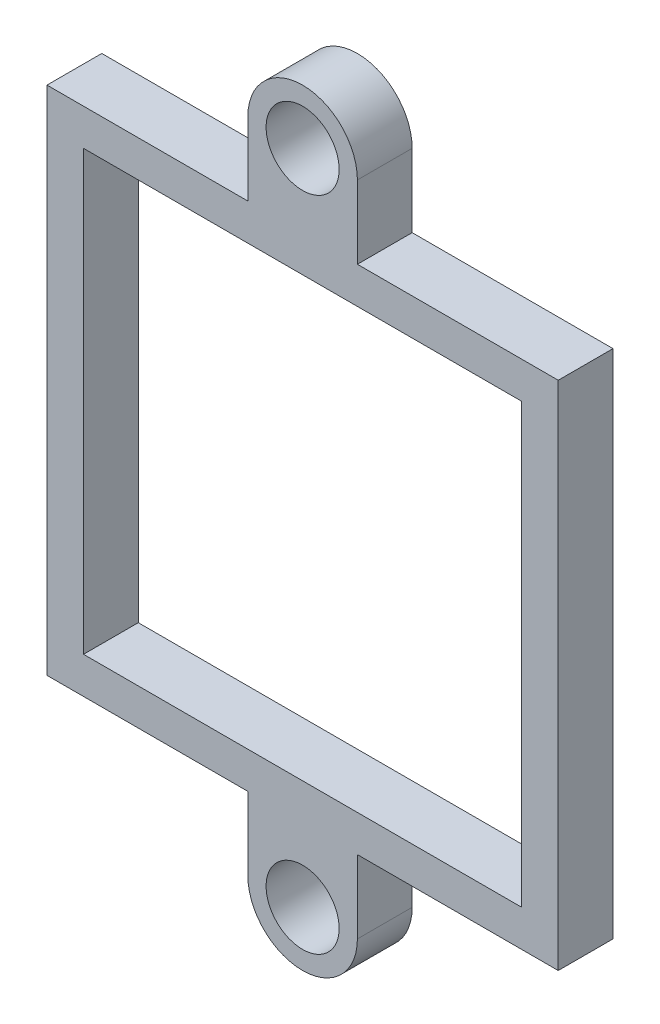
from build123d import *

# Parameters (mm, degrees)
SKETCH_6_W          = 14
SKETCH_6_H          = 14
SKETCH_6_W_2        = 12
SKETCH_6_H_2        = 12
EXTRUDE_3_DEPTH     = 1.5
SKETCH_7_W          = 3
SKETCH_7_H          = 1.5
EXTRUDE_4_DEPTH     = 3.5
CUT_EXTRUDE_3_DEPTH = 4
SKETCH_11_R         = 1
CUT_EXTRUDE_5_DEPTH = 4


with BuildPart() as part:
    # 草图6 → 凸台-拉伸3 (new body)
    with BuildSketch(Plane.XY):
        Rectangle(SKETCH_6_W, SKETCH_6_H)
        Rectangle(SKETCH_6_W_2, SKETCH_6_H_2, mode=Mode.SUBTRACT)
    extrude(amount=EXTRUDE_3_DEPTH)

    # 草图7 → 凸台-拉伸4 (add)
    with BuildSketch(Plane.XZ.offset(7)):
        with Locations((0, 0.75)):
            Rectangle(SKETCH_7_W, SKETCH_7_H)
    extrude_4 = extrude(amount=EXTRUDE_4_DEPTH)

    # 草图8 → 切除-拉伸3 (cut)
    with BuildSketch(Plane.XY.offset(1.5)):
        with BuildLine():
            ThreePointArc((0, -10.5), (-1.060660172, -10.060660172), (-1.5, -9))
            Line((-1.5, -9), (-1.5, -10.5))
            Line((-1.5, -10.5), (0, -10.5))
        make_face()
        with BuildLine():
            Line((1.5, -10.5), (1.5, -9))
            ThreePointArc((1.5, -9), (1.060660172, -10.060660172), (0, -10.5))
            Line((0, -10.5), (1.5, -10.5))
        make_face()
    cut_extrude_3 = extrude(amount=-CUT_EXTRUDE_3_DEPTH, mode=Mode.SUBTRACT)

    # 草图11 → 切除-拉伸5 (cut)
    with BuildSketch(Plane.XY.offset(1.5)):
        with Locations((0, -9)):
            Circle(SKETCH_11_R)
    cut_extrude_5 = extrude(amount=-CUT_EXTRUDE_5_DEPTH, mode=Mode.SUBTRACT)

    # 镜向1: 凸台-拉伸4, 切除-拉伸3, 切除-拉伸5 across plane
    add(extrude_4.mirror(Plane.ZX))
    add(cut_extrude_3.mirror(Plane.ZX), mode=Mode.SUBTRACT)
    add(cut_extrude_5.mirror(Plane.ZX), mode=Mode.SUBTRACT)


solid = part.part
